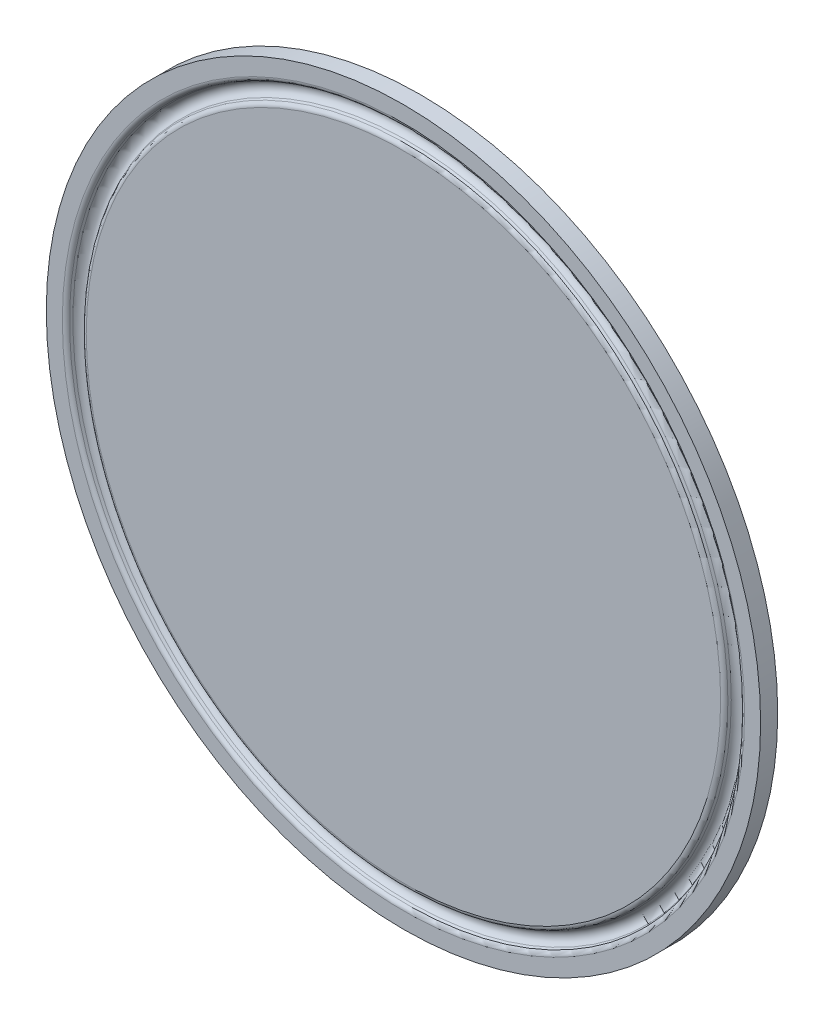
from build123d import *


with BuildPart() as part:
    # Sketch1 → Revolve1 (revolve)
    with BuildSketch(Plane(origin=(0, 0, 0), x_dir=(0, 0, -1), z_dir=(1, 0, 0)), mode=Mode.PRIVATE) as revolve1_sk:
        with BuildLine():
            Line((0, 0), (0, 52.809927725))
            ThreePointArc((0, 52.809927725), (0.130798304, 53.244522907), (0.479738309, 53.534733247))
            Line((0.479738309, 53.534733247), (0.872854821, 53.701601306))
            ThreePointArc((0.872854821, 53.701601306), (1.6002, 54.8005), (0.872854821, 55.899398694))
            Line((0.872854821, 55.899398694), (0.479738309, 56.066266753))
            ThreePointArc((0.479738309, 56.066266753), (0.130798304, 56.356477093), (0, 56.791072275))
            Line((0, 56.791072275), (0, 59.4614))
            Line((0, 59.4614), (2.8448, 59.4614))
            Line((2.8448, 59.4614), (7.9248, 45.504214709))
            Line((7.9248, 45.504214709), (7.9248, 0))
            Line((7.9248, 0), (0, 0))
        make_face()
    revolve(revolve1_sk.sketch.rotate(Axis((0, 0, 0), (0, 0, -1)), 90), axis=Axis((0, 0, 0), (0, 0, -1)))


solid = part.part
